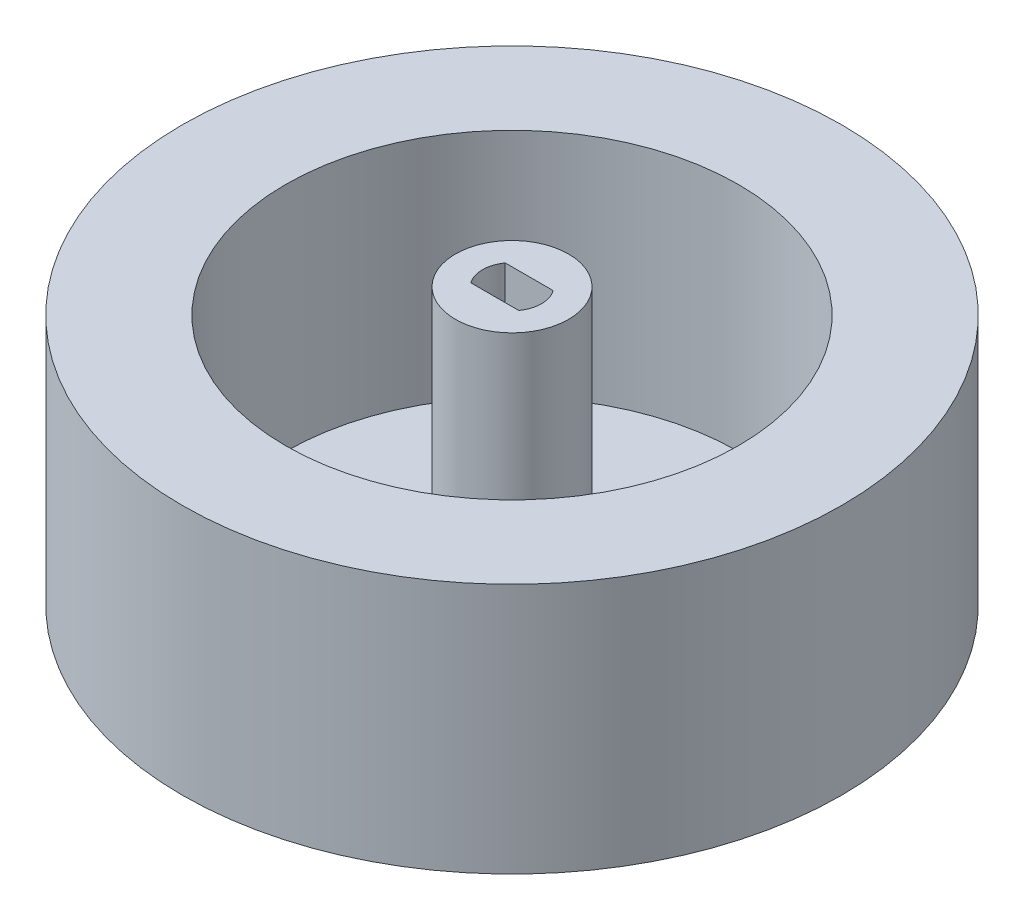
from build123d import *

# Parameters (mm, degrees)
SKETCH_1_R          = 33.5
EXTRUDE_1_DEPTH     = 25.5
SKETCH_2_R          = 23
CUT_EXTRUDE_1_DEPTH = 23.5
SKETCH_3_R          = 5.75
EXTRUDE_2_DEPTH     = 26
CUT_EXTRUDE_2_DEPTH = 20


with BuildPart() as part:
    # Эскиз1 → Бобышка-Вытянуть1 (new body)
    with BuildSketch(Plane(origin=(0, 0, 0), x_dir=(1, 0, 0), z_dir=(0, 1, 0))):
        with Locations(Location((0, 0, 0), (0, 0, 270))):
            Circle(SKETCH_1_R)
    extrude(amount=EXTRUDE_1_DEPTH)

    # Эскиз2 → Вырез-Вытянуть1 (cut)
    with BuildSketch(Plane(origin=(0, 25.5, 0), x_dir=(1, 0, 0), z_dir=(0, 1, 0))):
        with Locations(Location((0, 0, 0), (0, 0, 270))):
            Circle(SKETCH_2_R)
    extrude(amount=-CUT_EXTRUDE_1_DEPTH, mode=Mode.SUBTRACT)

    # Эскиз3 → Бобышка-Вытянуть2 (add)
    with BuildSketch(Plane(origin=(0, 2, 0), x_dir=(1, 0, 0), z_dir=(0, 1, 0))):
        with Locations(Location((0, 0, 0), (0, 0, 90))):
            Circle(SKETCH_3_R)
    extrude(amount=EXTRUDE_2_DEPTH)

    # Эскиз4 → Вырез-Вытянуть2 (cut)
    with BuildSketch(Plane(origin=(0, 28, 0), x_dir=(1, 0, 0), z_dir=(0, 1, 0))):
        with BuildLine():
            Line((2.436698586, 1.75), (-2.436698586, 1.75))
            ThreePointArc((-2.436698586, 1.75), (-3, 0), (-2.436698586, -1.75))
            Line((-2.436698586, -1.75), (2.436698586, -1.75))
            ThreePointArc((2.436698586, -1.75), (2.855704445, -0.919212772), (3, 0))
            ThreePointArc((3, 0), (2.855704445, 0.919212772), (2.436698586, 1.75))
        make_face()
    extrude(amount=-CUT_EXTRUDE_2_DEPTH, mode=Mode.SUBTRACT)


solid = part.part
